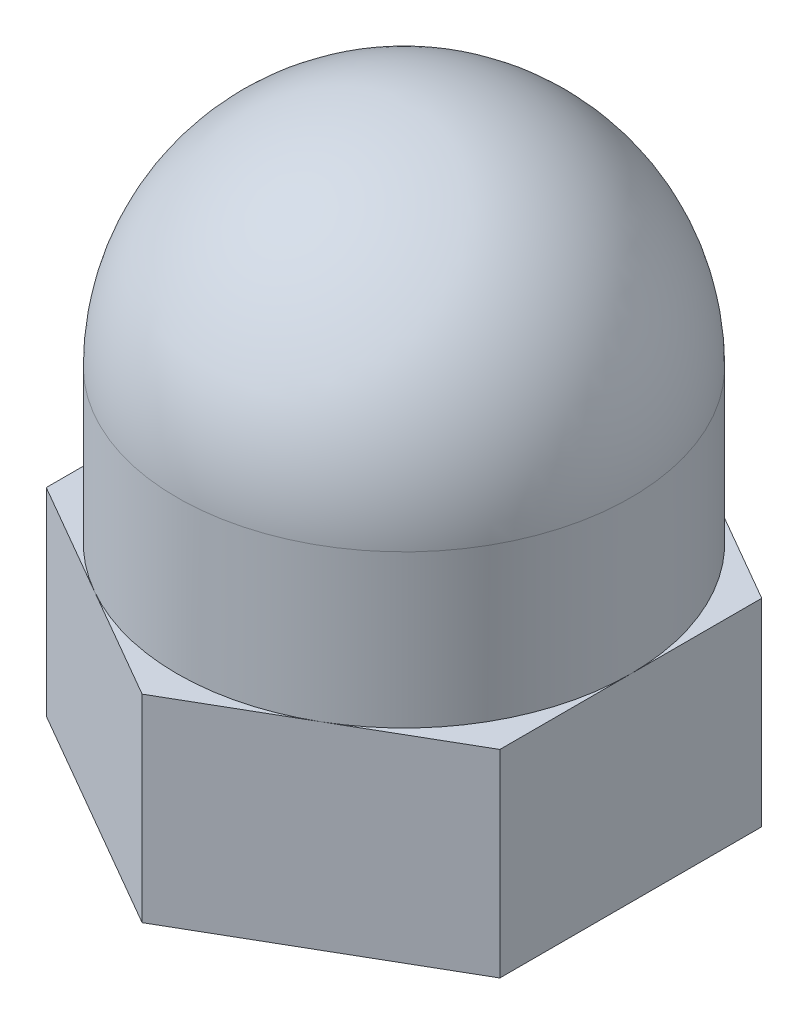
from build123d import *

# Parameters (mm, degrees)
SZKIC1_R                    = 1.5
DODANIE_WYCI_GNI_CIE1_DEPTH = 2.4


with BuildPart() as part:
    # Szkic1 → Dodanie-wyciągnięcie1 (new body)
    with BuildSketch(Plane(origin=(0, 0, 0), x_dir=(1, 0, 0), z_dir=(0, 1, 0))):
        Polygon((0, 3.175426481), (-2.75, 1.58771324), (-2.75, -1.58771324), (0, -3.175426481), (2.75, -1.58771324), (2.75, 1.58771324), align=None)
        with Locations(Location((0, 0, 0), (0, 0, 270))):
            Circle(SZKIC1_R, mode=Mode.SUBTRACT)
    extrude(amount=DODANIE_WYCI_GNI_CIE1_DEPTH)

    # Szkic3 → Obrót2 (revolve)
    with BuildSketch(Plane.XY, mode=Mode.PRIVATE) as obr_t2_sk:
        with BuildLine():
            Line((0, 7), (0, 2.4))
            Line((0, 2.4), (2.75, 2.4))
            Line((2.75, 2.4), (2.75, 4.25))
            ThreePointArc((2.75, 4.25), (1.944543648, 6.194543648), (0, 7))
        make_face()
    revolve(obr_t2_sk.sketch.rotate(Axis((0, 7, 0), (0, -1, 0)), 180), axis=Axis((0, 7, 0), (0, -1, 0)))


solid = part.part
